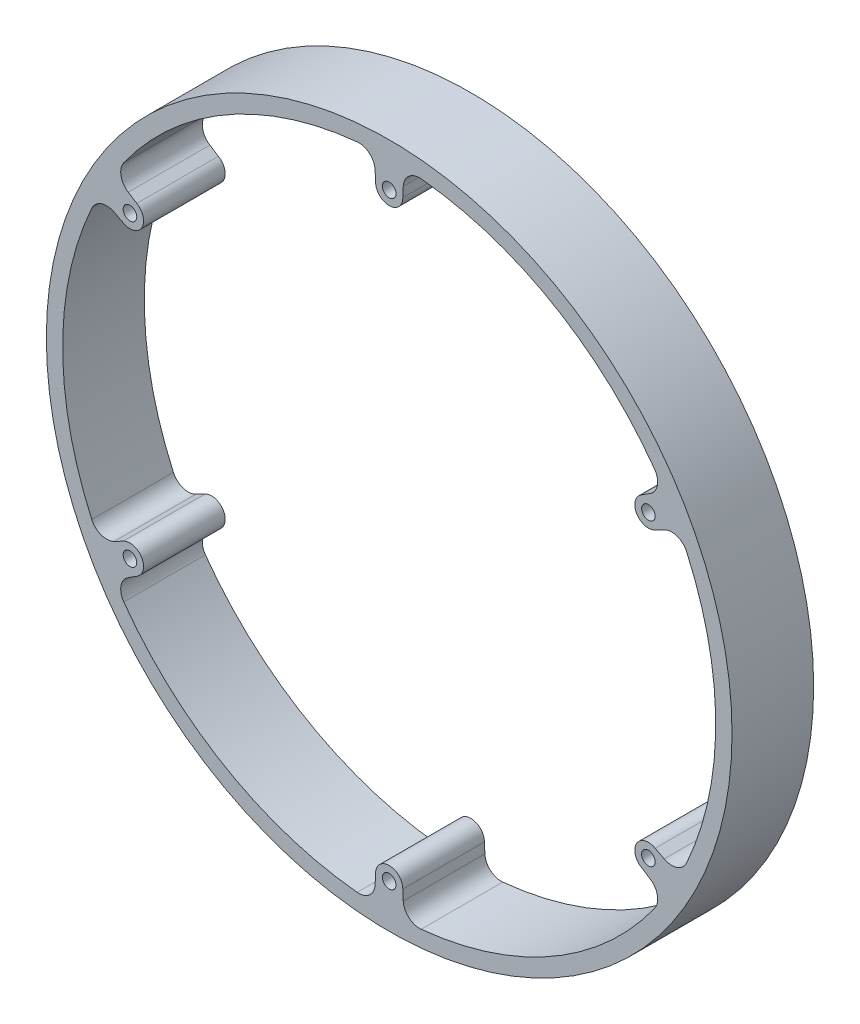
from build123d import *

# Parameters (mm, degrees)
SKETCH_1_R      = 63
SKETCH_1_R_2    = 1.25
EXTRUDE_1_DEPTH = 15
FILLET_1_R      = 3


with BuildPart() as part:
    # 草图1 → 凸台-拉伸1 (new body)
    with BuildSketch(Plane.XY):
        Circle(SKETCH_1_R)
        with Locations((0, 55)):
            Circle(SKETCH_1_R_2, mode=Mode.SUBTRACT)
        with Locations((47.631397208, 27.5)):
            Circle(SKETCH_1_R_2, mode=Mode.SUBTRACT)
        with Locations((47.631397208, -27.5)):
            Circle(SKETCH_1_R_2, mode=Mode.SUBTRACT)
        with Locations((0, -55)):
            Circle(SKETCH_1_R_2, mode=Mode.SUBTRACT)
        with Locations((-47.631397208, -27.5)):
            Circle(SKETCH_1_R_2, mode=Mode.SUBTRACT)
        with Locations((-47.631397208, 27.5)):
            Circle(SKETCH_1_R_2, mode=Mode.SUBTRACT)
        with BuildLine():
            Line((-2.5, 55), (-2.724459655, 59.938112413))
            ThreePointArc((-2.724459655, 59.938112413), (-30, 51.961524227), (-50.545698177, 32.328507479))
            Line((-50.545698177, 32.328507479), (-46.381397208, 29.665063509))
            ThreePointArc((-46.381397208, 29.665063509), (-45.466333699, 26.25), (-48.881397208, 25.334936491))
            Line((-48.881397208, 25.334936491), (-53.270157832, 27.609604933))
            ThreePointArc((-53.270157832, 27.609604933), (-60, 0), (-53.270157832, -27.609604933))
            Line((-53.270157832, -27.609604933), (-48.881397208, -25.334936491))
            ThreePointArc((-48.881397208, -25.334936491), (-45.466333699, -26.25), (-46.381397208, -29.665063509))
            Line((-46.381397208, -29.665063509), (-50.545698177, -32.328507479))
            ThreePointArc((-50.545698177, -32.328507479), (-30, -51.961524227), (-2.724459655, -59.938112413))
            Line((-2.724459655, -59.938112413), (-2.5, -55))
            ThreePointArc((-2.5, -55), (0, -52.5), (2.5, -55))
            Line((2.5, -55), (2.724459655, -59.938112413))
            ThreePointArc((2.724459655, -59.938112413), (30, -51.961524227), (50.545698177, -32.328507479))
            Line((50.545698177, -32.328507479), (46.381397208, -29.665063509))
            ThreePointArc((46.381397208, -29.665063509), (45.466333699, -26.25), (48.881397208, -25.334936491))
            Line((48.881397208, -25.334936491), (53.270157832, -27.609604933))
            ThreePointArc((53.270157832, -27.609604933), (60, 0), (53.270157832, 27.609604933))
            Line((53.270157832, 27.609604933), (48.881397208, 25.334936491))
            ThreePointArc((48.881397208, 25.334936491), (45.466333699, 26.25), (46.381397208, 29.665063509))
            Line((46.381397208, 29.665063509), (50.545698177, 32.328507479))
            ThreePointArc((50.545698177, 32.328507479), (30, 51.961524227), (2.724459655, 59.938112413))
            Line((2.724459655, 59.938112413), (2.5, 55))
            ThreePointArc((2.5, 55), (0, 52.5), (-2.5, 55))
        make_face(mode=Mode.SUBTRACT)
    extrude(amount=EXTRUDE_1_DEPTH)

    # 圆角1
    fillet_1_edges = [part.edges().sort_by_distance(p)[0] for p in [
        (-2.724459655, 59.938112413, 7.5),
        (-50.545698177, 32.328507479, 7.5),
        (-53.270157832, 27.609604933, 7.5),
        (-53.270157832, -27.609604933, 7.5),
        (-50.545698177, -32.328507479, 7.5),
        (-2.724459655, -59.938112413, 7.5),
        (2.724459655, -59.938112413, 7.5),
        (50.545698177, -32.328507479, 7.5),
        (53.270157832, -27.609604933, 7.5),
        (53.270157832, 27.609604933, 7.5),
        (50.545698177, 32.328507479, 7.5),
        (2.724459655, 59.938112413, 7.5),
    ]]
    fillet(fillet_1_edges, radius=FILLET_1_R)


solid = part.part
